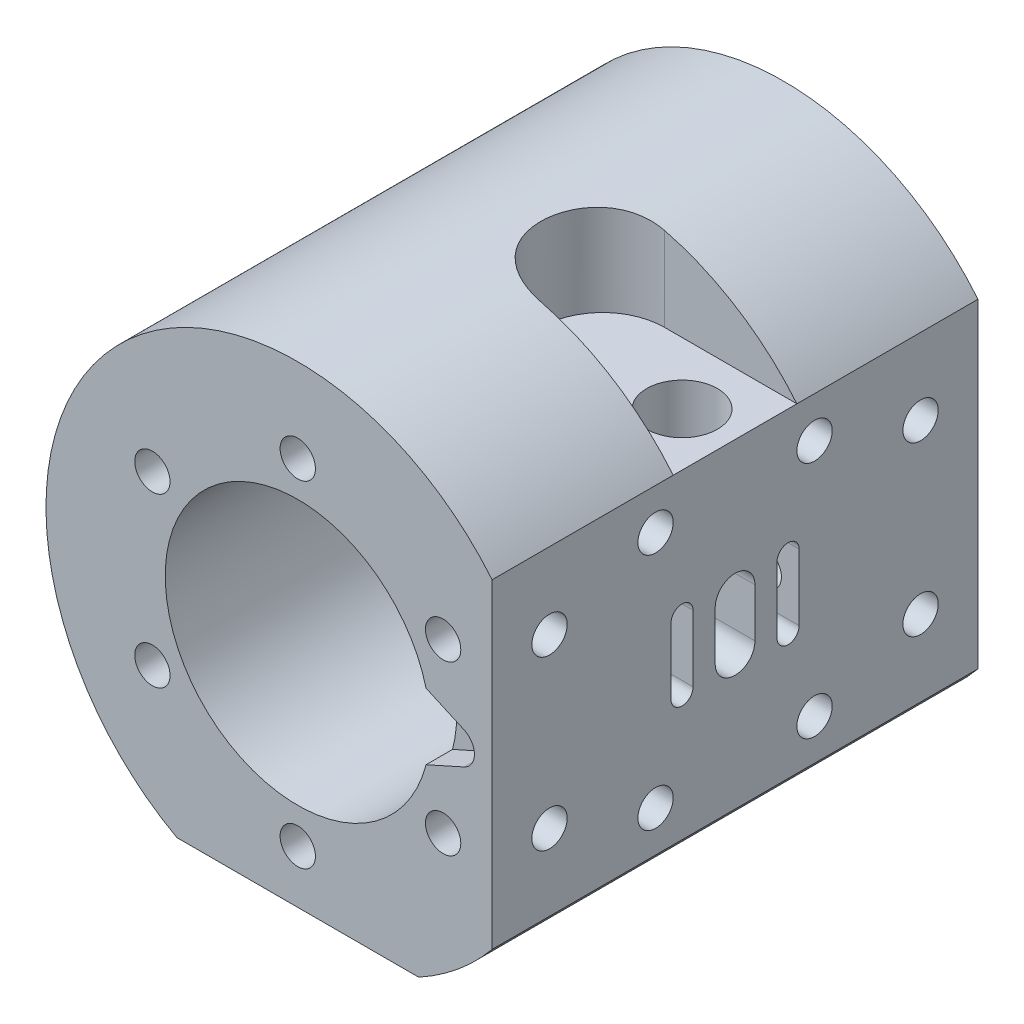
from build123d import *

# Parameters (mm, degrees)
SKETCH1_R           = 15
BOSS_EXTRUDE1_DEPTH = 27.5
SKETCH2_5_R         = 2
CUT_EXTRUDE1_DEPTH  = 10
CUT_EXTRUDE2_START  = -3
CUT_EXTRUDE2_DEPTH  = 3
CUT_EXTRUDE3_REACH  = 60.546
SKETCH4_R           = 2
CUT_EXTRUDE4_DEPTH  = 10
CUT_EXTRUDE5_REACH  = 66.177
CUT_EXTRUDE6_REACH  = 70.187
SKETCH5_R           = 3
CUT_EXTRUDE7_DEPTH  = 6


with BuildPart() as part:
    # Sketch1 → Boss-Extrude1 (new, symmetric)
    with BuildSketch(Plane.XY):
        with BuildLine():
            Line((22, -18.117670932), (22, 18.117670932))
            ThreePointArc((22, 18.117670932), (-21.956152501, 18.170783345), (-13.683932183, -25))
            Line((-13.683932183, -25), (13.683932183, -25))
            ThreePointArc((13.683932183, -25), (18.170783345, -21.956152501), (22, -18.117670932))
        make_face()
        Circle(SKETCH1_R, mode=Mode.SUBTRACT)
    extrude(amount=BOSS_EXTRUDE1_DEPTH, both=True)

    # Sketch2<5> → Cut-Extrude1 (cut)
    with BuildSketch(Plane.XY.offset(27.5)):
        with Locations((0, 19)):
            Circle(SKETCH2_5_R)
        with Locations((16.454482672, 9.5)):
            Circle(SKETCH2_5_R)
        with Locations((16.454482672, -9.5)):
            Circle(SKETCH2_5_R)
        with Locations((0, -19)):
            Circle(SKETCH2_5_R)
        with Locations((-16.454482672, -9.5)):
            Circle(SKETCH2_5_R)
        with Locations((-16.454482672, 9.5)):
            Circle(SKETCH2_5_R)
    cut_extrude1 = extrude(amount=-CUT_EXTRUDE1_DEPTH, mode=Mode.SUBTRACT)

    # Sketch2<3> → Cut-Extrude2 (cut)
    with BuildSketch(Plane.XY.offset(27.5).offset(CUT_EXTRUDE2_START)):
        with BuildLine():
            ThreePointArc((18.818074515, -1.825035366), (16, 0), (18.818074515, 1.825035366))
            Line((18.818074515, 1.825035366), (14.523687548, 3.75))
            ThreePointArc((14.523687548, 3.75), (14.880445444, 1.890064387), (15, 0))
            ThreePointArc((15, 0), (14.880445444, -1.890064387), (14.523687548, -3.75))
            Line((14.523687548, -3.75), (18.818074515, -1.825035366))
        make_face()
    cut_extrude2 = extrude(amount=CUT_EXTRUDE2_DEPTH, mode=Mode.SUBTRACT)

    # Sketch3 → Cut-Extrude3 (cut, up to next)
    with BuildSketch(Plane(origin=(0, 18.117670932, 0), x_dir=(1, 0, 0), z_dir=(0, 1, 0)), mode=Mode.PRIVATE) as cut_extrude3_sk1:
        with BuildLine():
            Line((22, 7), (22, -7))
            Line((22, -7), (7, -7))
            ThreePointArc((7, -7), (0, 0), (7, 7))
            Line((7, 7), (22, 7))
        make_face()
    cut_extrude3_tool1 = extrude(cut_extrude3_sk1.sketch, amount=CUT_EXTRUDE3_REACH, mode=Mode.PRIVATE) & part.part
    add(cut_extrude3_tool1.solids().sort_by_distance((11.691563, 18.117671, 0))[0], mode=Mode.SUBTRACT)

    # Sketch4 → Cut-Extrude4 (cut)
    with BuildSketch(Plane(origin=(22, 0, 0), x_dir=(0, 0, -1), z_dir=(1, 0, 0))):
        with Locations((-9, 13.5)):
            Circle(SKETCH4_R)
        with Locations((-21, 9.5)):
            Circle(SKETCH4_R)
        with Locations((9, 13.5)):
            Circle(SKETCH4_R)
        with Locations((21, 9.5)):
            Circle(SKETCH4_R)
        with Locations((21, -9.5)):
            Circle(SKETCH4_R)
        with Locations((9, -13.5)):
            Circle(SKETCH4_R)
        with Locations((-9, -13.5)):
            Circle(SKETCH4_R)
        with Locations((-21, -9.5)):
            Circle(SKETCH4_R)
    extrude(amount=-CUT_EXTRUDE4_DEPTH, mode=Mode.SUBTRACT)

    # Sketch4<3> → Cut-Extrude5 (cut, up to next)
    with BuildSketch(Plane(origin=(22, 0, 0), x_dir=(0, 0, -1), z_dir=(1, 0, 0)), mode=Mode.PRIVATE) as cut_extrude5_sk1:
        with BuildLine():
            Line((2.25, -2.75), (2.25, 2.75))
            ThreePointArc((2.25, 2.75), (0, 5), (-2.25, 2.75))
            Line((-2.25, 2.75), (-2.25, -2.75))
            ThreePointArc((-2.25, -2.75), (0, -5), (2.25, -2.75))
        make_face()
    cut_extrude5_tool1 = extrude(cut_extrude5_sk1.sketch, amount=-CUT_EXTRUDE5_REACH, mode=Mode.PRIVATE) & part.part
    # Sketch4<3> → Cut-Extrude5 (cut, up to next)
    with BuildSketch(Plane(origin=(22, 0, 0), x_dir=(0, 0, -1), z_dir=(1, 0, 0)), mode=Mode.PRIVATE) as cut_extrude5_sk2:
        with BuildLine():
            Line((-4.75, -3.75), (-4.75, 3.75))
            ThreePointArc((-4.75, 3.75), (-6, 5), (-7.25, 3.75))
            Line((-7.25, 3.75), (-7.25, -3.75))
            ThreePointArc((-7.25, -3.75), (-6, -5), (-4.75, -3.75))
        make_face()
    cut_extrude5_tool2 = extrude(cut_extrude5_sk2.sketch, amount=-CUT_EXTRUDE5_REACH, mode=Mode.PRIVATE) & part.part
    # Sketch4<3> → Cut-Extrude5 (cut, up to next)
    with BuildSketch(Plane(origin=(22, 0, 0), x_dir=(0, 0, -1), z_dir=(1, 0, 0)), mode=Mode.PRIVATE) as cut_extrude5_sk3:
        with BuildLine():
            ThreePointArc((7.25, 3.75), (6, 5), (4.75, 3.75))
            Line((4.75, 3.75), (4.75, -3.75))
            ThreePointArc((4.75, -3.75), (6, -5), (7.25, -3.75))
            Line((7.25, -3.75), (7.25, 3.75))
        make_face()
    cut_extrude5_tool3 = extrude(cut_extrude5_sk3.sketch, amount=-CUT_EXTRUDE5_REACH, mode=Mode.PRIVATE) & part.part
    add(cut_extrude5_tool1.solids().sort_by_distance((22, 0, 0))[0], mode=Mode.SUBTRACT)
    add(cut_extrude5_tool2.solids().sort_by_distance((22, 0, 6))[0], mode=Mode.SUBTRACT)
    add(cut_extrude5_tool3.solids().sort_by_distance((22, 0, -6))[0], mode=Mode.SUBTRACT)

    # Sketch2 → Cut-Extrude6 (cut, up to next)
    with BuildSketch(Plane.XY.offset(27.5), mode=Mode.PRIVATE) as cut_extrude6_sk1:
        with BuildLine():
            ThreePointArc((20, 0), (19.67871216, 1.087163964), (18.818074515, 1.825035366))
            ThreePointArc((18.818074515, 1.825035366), (16, 0), (18.818074515, -1.825035366))
            ThreePointArc((18.818074515, -1.825035366), (19.67871216, -1.087163964), (20, 0))
        make_face()
    cut_extrude6_tool1 = extrude(cut_extrude6_sk1.sketch, amount=-CUT_EXTRUDE6_REACH, mode=Mode.PRIVATE) & part.part
    cut_extrude6 = cut_extrude6_tool1.solids().sort_by_distance((18, 0, 27.5))[0]
    add(cut_extrude6, mode=Mode.SUBTRACT)

    # Sketch5 → Cut-Extrude7 (cut)
    with BuildSketch(Plane.XZ.offset(25)):
        with Locations((0, 15)):
            Circle(SKETCH5_R)
        with Locations((0, -15)):
            Circle(SKETCH5_R)
    extrude(amount=-CUT_EXTRUDE7_DEPTH, mode=Mode.SUBTRACT)

    # Sketch8 → Cut-Revolve1 (revolve, cut)
    with BuildSketch(Plane.XY):
        Polygon((16, 18.117670932), (20, 18.117670932), (20, 11.117670932), (18.25, 10.117670932), (18.25, 3.04686437), (16, 3.04686437), align=None)
    revolve(axis=Axis((16, 18.117670932, 0), (0, -1, 0)), mode=Mode.SUBTRACT)

    # Mirror1: Cut-Extrude1, Cut-Extrude2, Cut-Extrude6 across plane
    add(cut_extrude1.mirror(Plane.XY), mode=Mode.SUBTRACT)
    add(cut_extrude2.mirror(Plane.XY), mode=Mode.SUBTRACT)
    add(cut_extrude6.mirror(Plane.XY), mode=Mode.SUBTRACT)


solid = part.part
